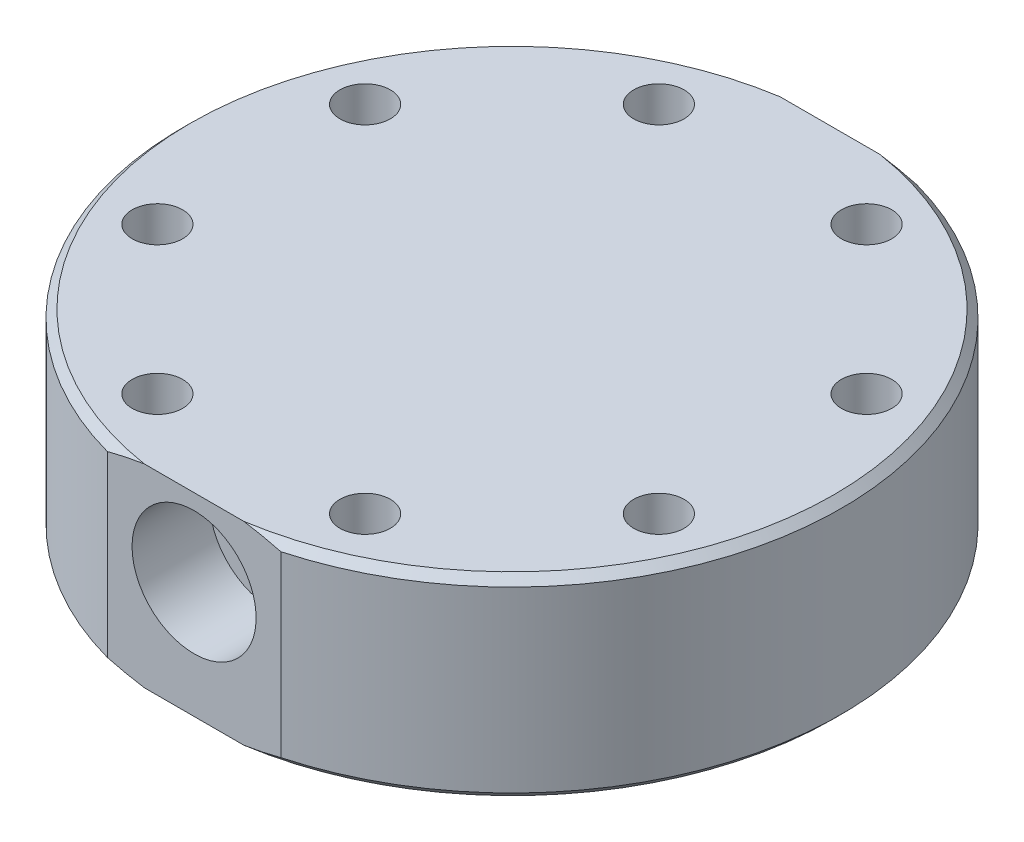
from build123d import *

# Parameters (mm, degrees)
SKETCH_1_R                    = 85
EXTRUDE_1_DEPTH               = 50
M14X1_5_1_D                   = 12.5
M14X1_5_1_DEPTH               = 34.5
M14X1_5_1_TIP                 = 3.755378869
HOLE_WIZARD_M12_1_D           = 13
HOLE_WIZARD_M12_1_CBORE_D     = 22
HOLE_WIZARD_M12_1_CBORE_DEPTH = 15
PATTERN_CIRCULAR_1_COUNT      = 8
SKETCH_6_W                    = 44.766058572
SKETCH_6_H                    = 9.083836387
SKETCH_6_H_2                  = 8.147377862
CUT_EXTRUDE_1_DEPTH           = 131.192165663
SKETCH_7_R                    = 16
CUT_EXTRUDE_2_DEPTH           = 20
SKETCH_8_R                    = 9
CUT_EXTRUDE_3_DEPTH           = 175.530799574
CHAMFER_1_SIZE                = 2
CHAMFER_2_SIZE                = 0.5


with BuildPart() as part:
    # 草圖1 → 填料-伸長1 (new body)
    with BuildSketch(Plane(origin=(0, 0, 0), x_dir=(1, 0, 0), z_dir=(0, 1, 0))):
        with Locations(Location((0, 0, 0), (0, 0, 270))):
            Circle(SKETCH_1_R)
    extrude(amount=EXTRUDE_1_DEPTH)

    # M14x1.5 螺紋孔1
    with Locations(Plane.XZ):
        with Locations((43, -27), (43, 27), (-43, 27), (-43, -27)):
            Hole(M14X1_5_1_D / 2, depth=M14X1_5_1_DEPTH)
            with Locations((0, 0, -(M14X1_5_1_DEPTH + M14X1_5_1_TIP / 2))):  # 118° drill point
                Cone(0, M14X1_5_1_D / 2, M14X1_5_1_TIP, mode=Mode.SUBTRACT)

    # M12 六角頭螺栓的柱孔1 (through all)
    with Locations(Plane.XZ):
        with Locations((-64.671567276, 26.787840266)):
            hole_wizard_m12_1 = CounterBoreHole(HOLE_WIZARD_M12_1_D / 2, HOLE_WIZARD_M12_1_CBORE_D / 2, HOLE_WIZARD_M12_1_CBORE_DEPTH)

    # 環狀複製排列1: M12 六角頭螺栓的柱孔1 ×8 about axis
    pattern_circular_1_axis = Axis((0, 0, 0), (0, 1, 0))
    for i in range(1, PATTERN_CIRCULAR_1_COUNT):
        add(hole_wizard_m12_1.rotate(pattern_circular_1_axis, i * 360 / PATTERN_CIRCULAR_1_COUNT), mode=Mode.SUBTRACT)

    # 草圖6 → 除料-伸長1 (cut, through all)
    with BuildSketch(Plane(origin=(0, 50, 0), x_dir=(1, 0, 0), z_dir=(0, 1, 0))):
        with Locations((0, 86.541918194)):
            Rectangle(SKETCH_6_W, SKETCH_6_H)
        with Locations((0, -86.073688931)):
            Rectangle(SKETCH_6_W, SKETCH_6_H_2)
    extrude(amount=-CUT_EXTRUDE_1_DEPTH, mode=Mode.SUBTRACT)

    # 草圖7 → 除料-伸長2 (cut)
    with BuildSketch(Plane(origin=(0, 0, -82), x_dir=(-1, 0, 0), z_dir=(0, 0, -1))):
        with Locations((0, 30)):
            Circle(SKETCH_7_R)
    cut_extrude_2 = extrude(amount=-CUT_EXTRUDE_2_DEPTH, mode=Mode.SUBTRACT)

    # 鏡射1: 除料-伸長2 across plane
    add(cut_extrude_2.mirror(Plane.XY), mode=Mode.SUBTRACT)

    # 草圖8 → 除料-伸長3 (cut, through all)
    with BuildSketch(Plane.XY.offset(62)):
        with Locations((0, 30)):
            Circle(SKETCH_8_R)
    extrude(amount=-CUT_EXTRUDE_3_DEPTH, mode=Mode.SUBTRACT)

    # 導角1
    chamfer_1_edges = [part.edges().sort_by_distance(p)[0] for p in [
        (-85, 50, 0),
        (-85, 0, 0),
        (85, 50, 0),
        (85, 0, 0),
    ]]
    chamfer(chamfer_1_edges, length=CHAMFER_1_SIZE)

    # 導角2
    chamfer_2_edges = [part.edges().sort_by_distance(p)[0] for p in [
        (-36.75, 0, 27),
        (49.25, 0, 27),
        (49.25, 0, -27),
        (-26.787840266, 0, -75.671567276),
    ]]
    chamfer(chamfer_2_edges, length=CHAMFER_2_SIZE)


solid = part.part
